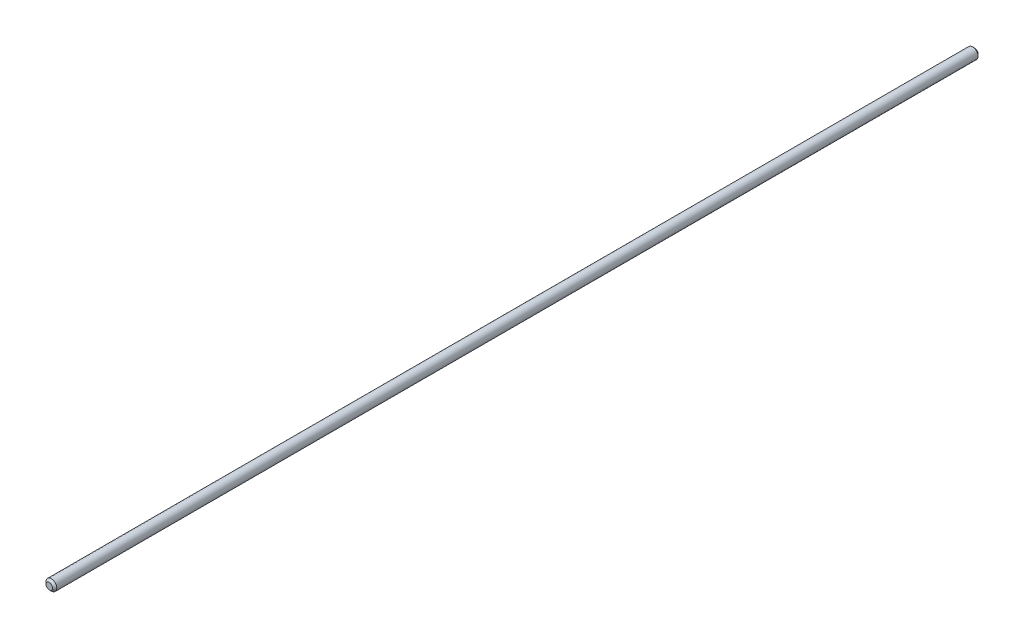
from build123d import *

# Parameters (mm, degrees)
SKETCH1_R           = 2.5
BOSS_EXTRUDE1_DEPTH = 214.5
CHAMFER1_SIZE       = 1


with BuildPart() as part:
    # Sketch1 → Boss-Extrude1 (new, symmetric)
    with BuildSketch(Plane.XY):
        Circle(SKETCH1_R)
    extrude(amount=BOSS_EXTRUDE1_DEPTH, both=True)

    # Chamfer1
    chamfer1_edges = [part.edges().sort_by_distance(p)[0] for p in [
        (-2.5, 0, -214.5),
        (-2.5, 0, 214.5),
    ]]
    chamfer(chamfer1_edges, length=CHAMFER1_SIZE)


solid = part.part
